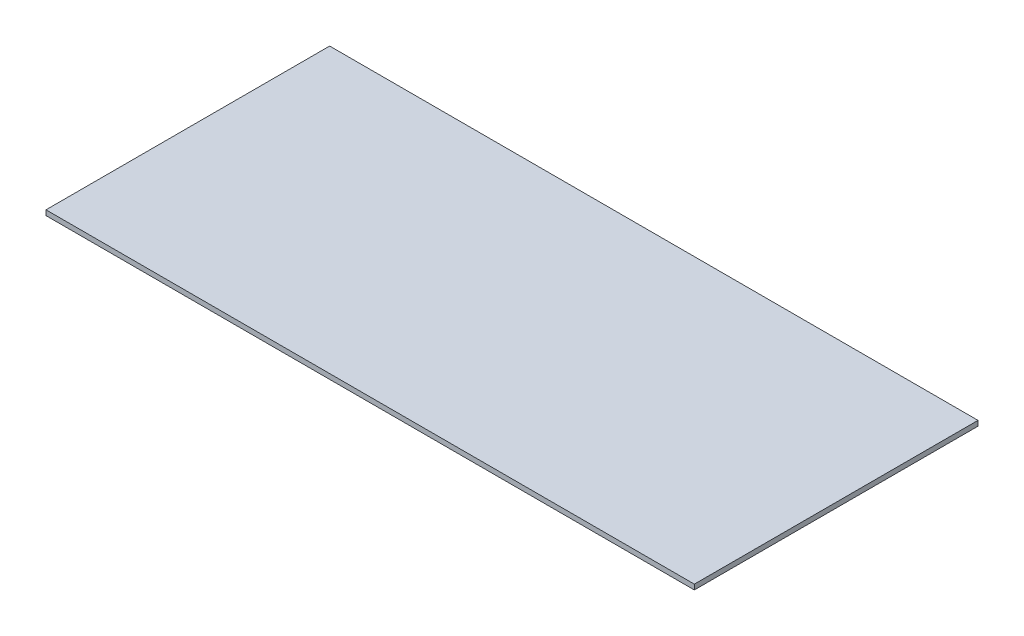
from build123d import *

# Parameters (mm, degrees)
SKETCH2_W           = 203.2
SKETCH2_H           = 88.9
BOSS_EXTRUDE1_DEPTH = 1.5875


with BuildPart() as part:
    # Sketch2 → Boss-Extrude1 (new body)
    with BuildSketch(Plane(origin=(0, 0, 0), x_dir=(1, 0, 0), z_dir=(0, 1, 0))):
        Rectangle(SKETCH2_W, SKETCH2_H)
    extrude(amount=BOSS_EXTRUDE1_DEPTH)


solid = part.part
